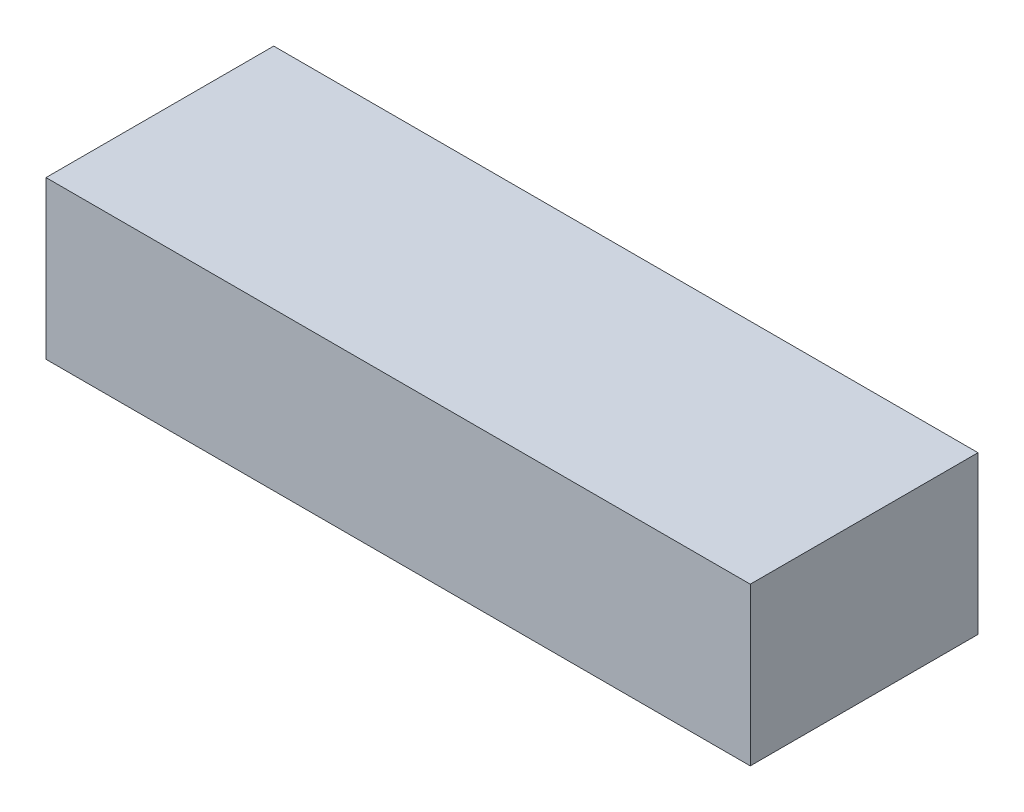
from build123d import *

# Parameters (mm, degrees)
SKETCH_1_W      = 105.15
SKETCH_1_H      = 34
EXTRUDE_1_DEPTH = 23.5


with BuildPart() as part:
    # 草圖1 → 填料-伸長1 (new body)
    with BuildSketch(Plane(origin=(0, 0, 0), x_dir=(1, 0, 0), z_dir=(0, 1, 0))):
        Rectangle(SKETCH_1_W, SKETCH_1_H)
    extrude(amount=EXTRUDE_1_DEPTH)


solid = part.part
